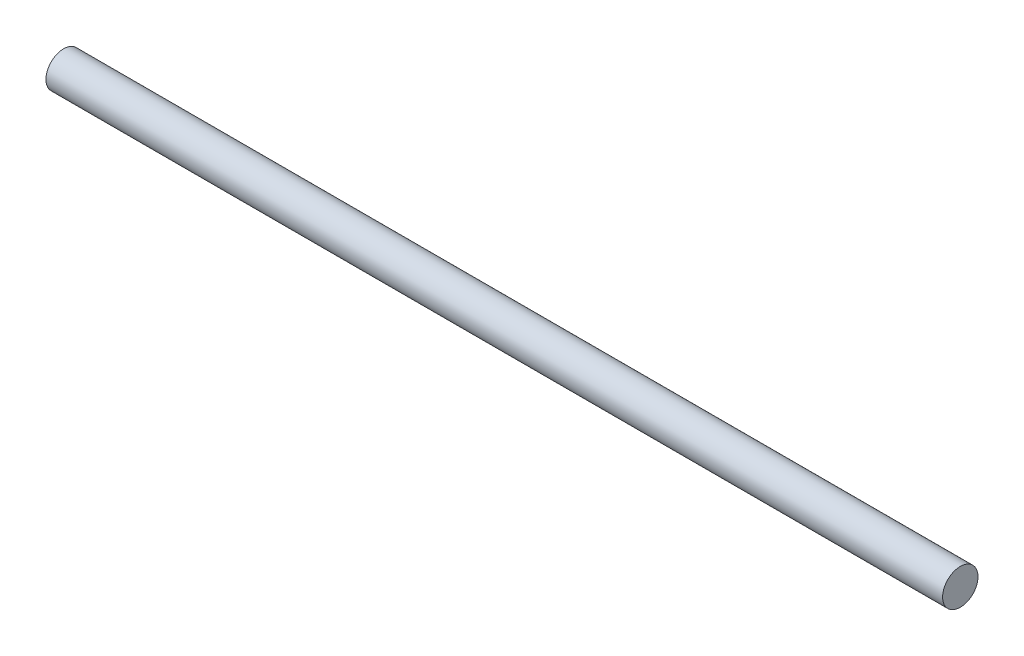
from build123d import *

# Parameters (mm, degrees)
SKETCH1_R           = 2.35
BOSS_EXTRUDE1_DEPTH = 59.5


with BuildPart() as part:
    # Sketch1 → Boss-Extrude1 (new, symmetric)
    with BuildSketch(Plane(origin=(0, 0, 0), x_dir=(0, 0, -1), z_dir=(1, 0, 0))):
        Circle(SKETCH1_R)
    extrude(amount=BOSS_EXTRUDE1_DEPTH, both=True)


solid = part.part
